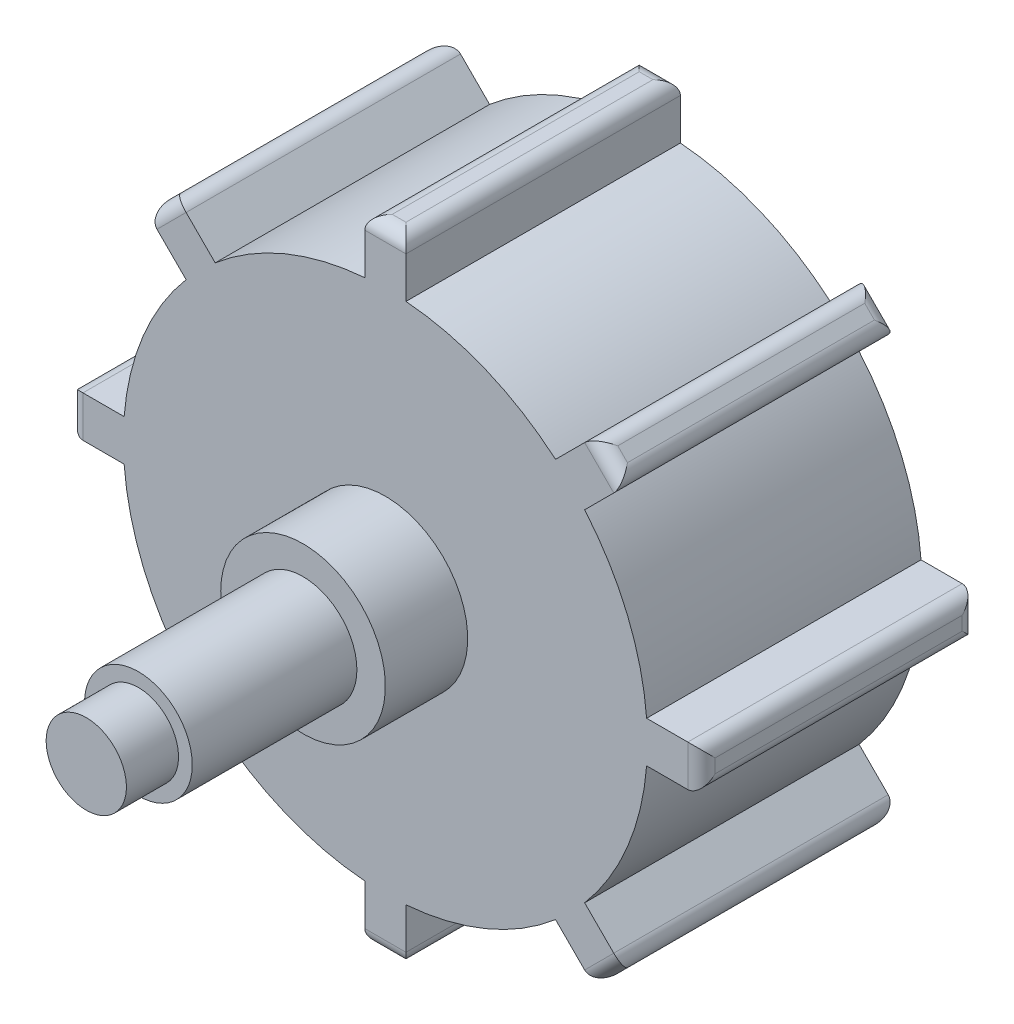
from build123d import *

# Parameters (mm, degrees)
SKIZZE1_R                       = 3.925
AUFSATZ_LINEAR_AUSTRAGEN1_DEPTH = 12
SKIZZE2_R                       = 6
AUFSATZ_LINEAR_AUSTRAGEN2_DEPTH = 6
SKIZZE3_R                       = 19.098593171
AUFSATZ_LINEAR_AUSTRAGEN3_DEPTH = 20
SKIZZE4_R                       = 6.075
SCHNITT_LINEAR_AUSTRAGEN1_DEPTH = 10
VERRUNDUNG1_R                   = 1
AUFSATZ_LINEAR_START            = -20
AUFSATZ_LINEAR_AUSTRAGEN4_DEPTH = 20
VERRUNDUNG2_R                   = 1
KREISMUSTER1_COUNT              = 8
VERRUNDUNG2_OF_KREISMUSTER1_R   = 1
SKIZZE6_R                       = 2.925
AUFSATZ_LINEAR_AUSTRAGEN5_DEPTH = 3.8


with BuildPart() as part:
    # Skizze1 → Aufsatz-Linear austragen1 (new body)
    with BuildSketch(Plane.XY):
        Circle(SKIZZE1_R)
    extrude(amount=AUFSATZ_LINEAR_AUSTRAGEN1_DEPTH)

    # Skizze2 → Aufsatz-Linear austragen2 (add)
    with BuildSketch(Plane(origin=(0, 0, 0), x_dir=(-1, 0, 0), z_dir=(0, 0, -1))):
        Circle(SKIZZE2_R)
    extrude(amount=AUFSATZ_LINEAR_AUSTRAGEN2_DEPTH)

    # Skizze3 → Aufsatz-Linear austragen3 (add)
    with BuildSketch(Plane(origin=(0, 0, -6), x_dir=(-1, 0, 0), z_dir=(0, 0, -1))):
        Circle(SKIZZE3_R)
    extrude(amount=AUFSATZ_LINEAR_AUSTRAGEN3_DEPTH)

    # Skizze4 → Schnitt-Linear austragen1 (cut)
    with BuildSketch(Plane(origin=(0, 0, -26), x_dir=(-1, 0, 0), z_dir=(0, 0, -1))):
        Circle(SKIZZE4_R)
    extrude(amount=-SCHNITT_LINEAR_AUSTRAGEN1_DEPTH, mode=Mode.SUBTRACT)

    # Verrundung1
    verrundung1_edges = [part.edges().sort_by_distance(p)[0] for p in [
        (6.075, 0, -26),
    ]]
    fillet(verrundung1_edges, radius=VERRUNDUNG1_R)

    # Skizze5 → Aufsatz-Linear austragen4 (add)
    with BuildSketch(Plane(origin=(0, 0, -26), x_dir=(-1, 0, 0), z_dir=(0, 0, -1)).offset(AUFSATZ_LINEAR_START)):
        with BuildLine():
            Line((0, 23.039597189), (0, 19.098593171))
            ThreePointArc((0, 19.098593171), (0.750579863, 19.083838476), (1.5, 19.039597189))
            Line((1.5, 19.039597189), (1.5, 23.039597189))
            Line((1.5, 23.039597189), (0, 23.039597189))
        make_face()
        with BuildLine():
            ThreePointArc((-1.5, 19.039597189), (-0.750579863, 19.083838476), (0, 19.098593171))
            Line((0, 19.098593171), (0, 23.039597189))
            Line((0, 23.039597189), (-1.5, 23.039597189))
            Line((-1.5, 23.039597189), (-1.5, 19.039597189))
        make_face()
    aufsatz_linear_austragen4 = extrude(amount=AUFSATZ_LINEAR_AUSTRAGEN4_DEPTH)

    # Verrundung2
    verrundung2_edges = [part.edges().sort_by_distance(p)[0] for p in [
        (-1.5, 23.039597189, -16),
        (0, 23.039597189, -6),
        (1.5, 23.039597189, -16),
        (0, 23.039597189, -26),
    ]]
    fillet(verrundung2_edges, radius=VERRUNDUNG2_R)

    # Kreismuster1: Aufsatz-Linear austragen4 ×8 about axis
    kreismuster1_axis = Axis((0, 0, 0), (0, 0, 1))
    for i in range(1, KREISMUSTER1_COUNT):
        add(aufsatz_linear_austragen4.rotate(kreismuster1_axis, i * 360 / KREISMUSTER1_COUNT))

    # Verrundung2 of Kreismuster1
    verrundung2_of_kreismuster1_edges = [part.edges().sort_by_distance(p)[0] for p in [
        (-17.35211558, 15.230795236, -16),
        (-16.291455408, 16.291455408, -6),
        (-15.230795236, 17.35211558, -16),
        (-16.291455408, 16.291455408, -26),
        (-23.039597189, -1.5, -16),
        (-23.039597189, 0, -6),
        (-23.039597189, 1.5, -16),
        (-23.039597189, 0, -26),
        (-15.230795236, -17.35211558, -16),
        (-16.291455408, -16.291455408, -6),
        (-17.35211558, -15.230795236, -16),
        (-16.291455408, -16.291455408, -26),
        (1.5, -23.039597189, -16),
        (0, -23.039597189, -6),
        (-1.5, -23.039597189, -16),
        (0, -23.039597189, -26),
        (17.35211558, -15.230795236, -16),
        (16.291455408, -16.291455408, -6),
        (15.230795236, -17.35211558, -16),
        (16.291455408, -16.291455408, -26),
        (23.039597189, 1.5, -16),
        (23.039597189, 0, -6),
        (23.039597189, -1.5, -16),
        (23.039597189, 0, -26),
        (15.230795236, 17.35211558, -16),
        (16.291455408, 16.291455408, -6),
        (17.35211558, 15.230795236, -16),
        (16.291455408, 16.291455408, -26),
    ]]
    fillet(verrundung2_of_kreismuster1_edges, radius=VERRUNDUNG2_OF_KREISMUSTER1_R)

    # Skizze6 → Aufsatz-Linear austragen5 (add)
    with BuildSketch(Plane.XY.offset(12)):
        with Locations(Location((0, 0, 0), (0, 0, 180))):
            Circle(SKIZZE6_R)
    extrude(amount=AUFSATZ_LINEAR_AUSTRAGEN5_DEPTH)


solid = part.part
